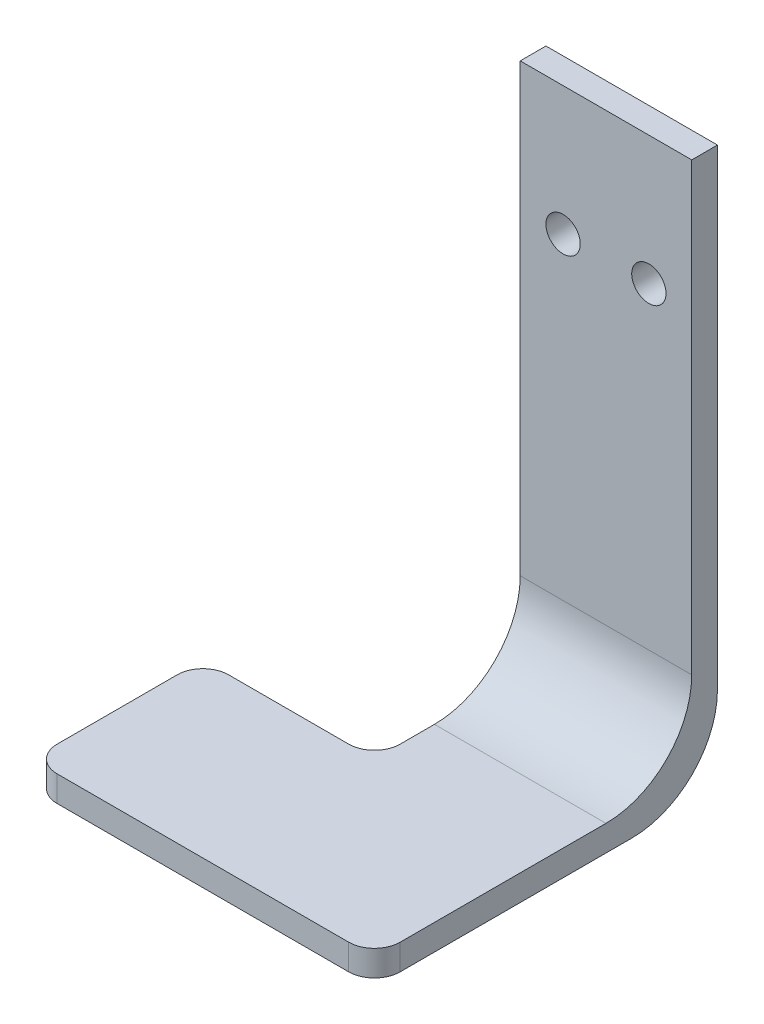
from build123d import *

# Parameters (mm, degrees)
SKETCH_1_W          = 20
SKETCH_1_H          = 65
SKETCH_1_R          = 2
EXTRUDE_1_DEPTH     = 3
SKETCH_2_W          = 40
SKETCH_2_H          = 3
EXTRUDE_2_DEPTH     = 40
SKETCH_3_W          = 20
SKETCH_3_H          = 20
CUT_EXTRUDE_1_DEPTH = 3
FILLET_1_R          = 10
FILLET_2_R          = 3


with BuildPart() as part:
    # 草图1 → 凸台-拉伸1 (new body)
    with BuildSketch(Plane.XY):
        with Locations((0, -32.5)):
            Rectangle(SKETCH_1_W, SKETCH_1_H)
        with Locations((-5, -15)):
            Circle(SKETCH_1_R, mode=Mode.SUBTRACT)
        with Locations((5, -15)):
            Circle(SKETCH_1_R, mode=Mode.SUBTRACT)
    extrude(amount=EXTRUDE_1_DEPTH)

    # 草图2 → 凸台-拉伸2 (add)
    with BuildSketch(Plane.XY):
        with Locations((-10, -63.5)):
            Rectangle(SKETCH_2_W, SKETCH_2_H)
    extrude(amount=EXTRUDE_2_DEPTH)

    # 草图3 → 切除-拉伸1 (cut)
    with BuildSketch(Plane(origin=(0, -62, 0), x_dir=(1, 0, 0), z_dir=(0, 1, 0))):
        with Locations((-20, -10)):
            Rectangle(SKETCH_3_W, SKETCH_3_H)
    extrude(amount=-CUT_EXTRUDE_1_DEPTH, mode=Mode.SUBTRACT)

    # 圆角1
    fillet_1_edges = [part.edges().sort_by_distance(p)[0] for p in [
        (0, -62, 3),
        (0, -65, 0),
    ]]
    fillet(fillet_1_edges, radius=FILLET_1_R)

    # 圆角2
    fillet_2_edges = [part.edges().sort_by_distance(p)[0] for p in [
        (-30, -63.5, 40),
        (10, -63.5, 40),
        (-30, -63.5, 20),
        (-10, -63.5, 20),
    ]]
    fillet(fillet_2_edges, radius=FILLET_2_R)


solid = part.part
